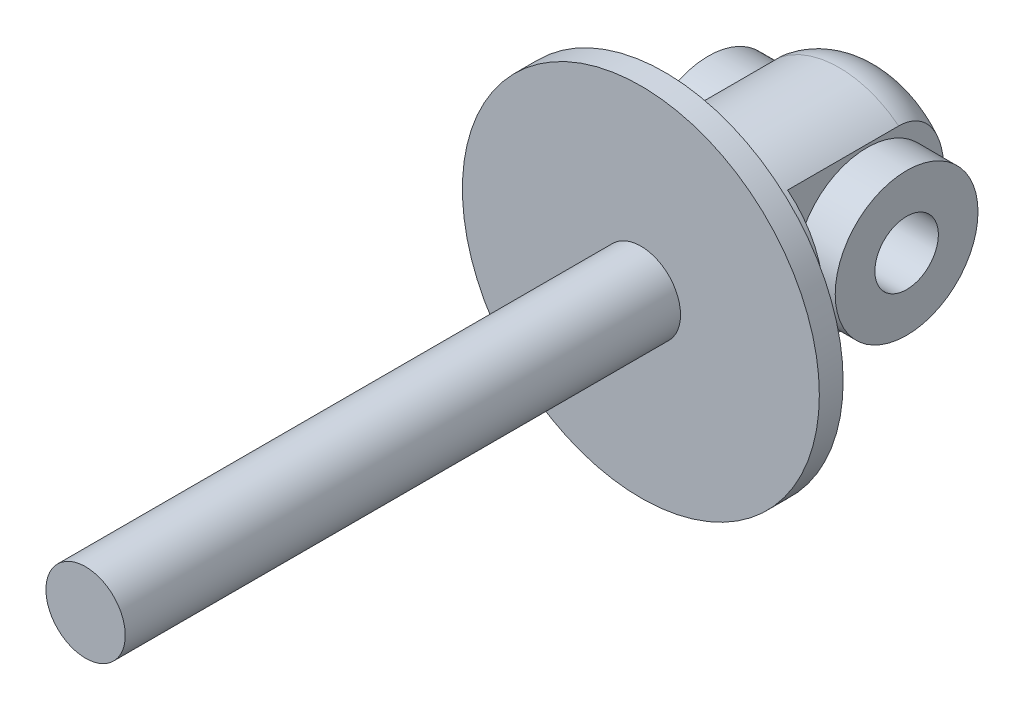
from build123d import *

# Parameters (mm, degrees)
SKETCH1_R               = 22.5
BOSS_EXTRUDE1_DEPTH     = 3
SKETCH2_R               = 5
BOSS_EXTRUDE2_DEPTH     = 70
SKETCH3_R               = 12
BOSS_EXTRUDE3_DEPTH     = 28
FILLET1_R               = 6
CUT_EXTRUDE1_DEPTH      = 80.633535649
CUT_EXTRUDE1_DEPTH_BACK = 80.633535649
SKETCH4_W               = 25.89224499
SKETCH4_H               = 20
SKETCH5_R               = 4
CUT_EXTRUDE3_DEPTH      = 83.068568892
SKETCH8_R               = 9
SKETCH8_R_2             = 4
BOSS_EXTRUDE4_DEPTH     = 12.5


with BuildPart() as part:
    # Sketch1 → Boss-Extrude1 (new body)
    with BuildSketch(Plane.XY):
        Circle(SKETCH1_R)
    extrude(amount=BOSS_EXTRUDE1_DEPTH)

    # Sketch2 → Boss-Extrude2 (add)
    with BuildSketch(Plane.XY.offset(3)):
        Circle(SKETCH2_R)
    extrude(amount=BOSS_EXTRUDE2_DEPTH)

    # Sketch3 → Boss-Extrude3 (add)
    with BuildSketch(Plane(origin=(0, 0, 0), x_dir=(-1, 0, 0), z_dir=(0, 0, -1))):
        Circle(SKETCH3_R)
    extrude(amount=BOSS_EXTRUDE3_DEPTH)

    # Fillet1
    fillet1_edges = [part.edges().sort_by_distance(p)[0] for p in [
        (12, 0, -28),
    ]]
    fillet(fillet1_edges, radius=FILLET1_R)

    # Sketch4 → Cut-Extrude1 (cut, two sides: drawn at the far end of the back side and taken through both)
    with BuildSketch(Plane(origin=(0, 0, 0), x_dir=(1, 0, 0), z_dir=(0, 1, 0)).offset(-CUT_EXTRUDE1_DEPTH_BACK)):
        with Locations((20.446122495, 18)):
            Rectangle(SKETCH4_W, SKETCH4_H)
        with Locations((-20.446122495, 18)):
            Rectangle(SKETCH4_W, SKETCH4_H)
    extrude(amount=CUT_EXTRUDE1_DEPTH + CUT_EXTRUDE1_DEPTH_BACK, mode=Mode.SUBTRACT)

    # Sketch5 → Cut-Extrude3 (cut, through all)
    with BuildSketch(Plane.ZY.offset(7.5)):
        with Locations((-18, 0)):
            Circle(SKETCH5_R)
    extrude(amount=-CUT_EXTRUDE3_DEPTH, mode=Mode.SUBTRACT)

    # Sketch8 → Boss-Extrude4 (add, symmetric)
    with BuildSketch(Plane(origin=(0, 0, 0), x_dir=(0, 0, -1), z_dir=(1, 0, 0))):
        with Locations(Location((18, 0, 0), (0, 0, 180))):
            Circle(SKETCH8_R)
        with Locations(Location((18, 0, 0), (0, 0, 180))):
            Circle(SKETCH8_R_2, mode=Mode.SUBTRACT)
    extrude(amount=BOSS_EXTRUDE4_DEPTH, both=True)


solid = part.part
